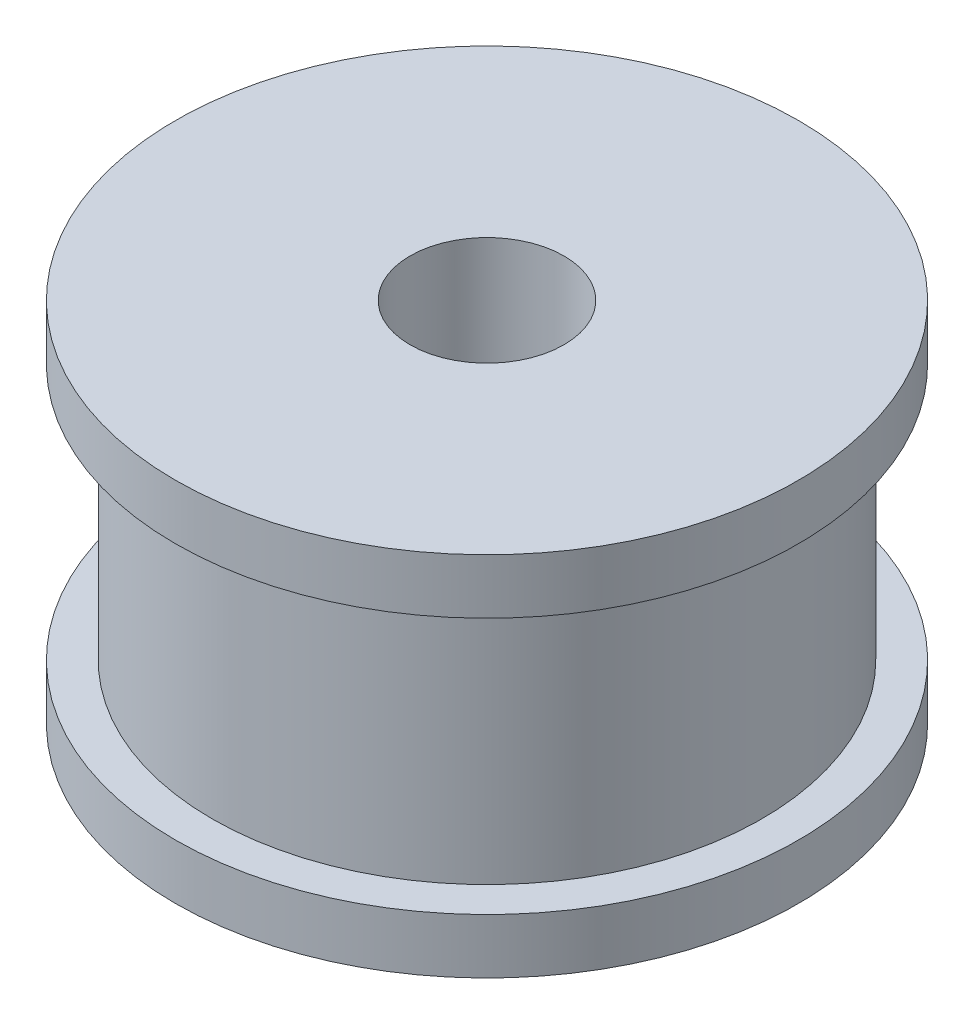
from build123d import *

# Parameters (mm, degrees)
SKETCH_1_R      = 7.5
SKETCH_1_R_2    = 2.1
EXTRUDE_1_DEPTH = 7
SKETCH_2_R      = 8.5
SKETCH_2_R_2    = 2.1
EXTRUDE_2_DEPTH = 1.5
EXTRUDE_START   = 1.5
SKETCH_3_R      = 8.5
SKETCH_3_R_2    = 2.1
EXTRUDE_3_DEPTH = 1.5


with BuildPart() as part:
    # 草图1 → 凸台-拉伸1 (new body)
    with BuildSketch(Plane(origin=(0, 0, 0), x_dir=(1, 0, 0), z_dir=(0, 1, 0))):
        with Locations(Location((0, 0, 0), (0, 0, 270))):
            Circle(SKETCH_1_R)
        with Locations(Location((0, 0, 0), (0, 0, 270))):
            Circle(SKETCH_1_R_2, mode=Mode.SUBTRACT)
    extrude(amount=EXTRUDE_1_DEPTH)

    # 草图2 → 凸台-拉伸2 (add)
    with BuildSketch(Plane(origin=(0, 7, 0), x_dir=(1, 0, 0), z_dir=(0, 1, 0))):
        with Locations(Location((0, 0, 0), (0, 0, 270))):
            Circle(SKETCH_2_R)
        with Locations(Location((0, 0, 0), (0, 0, 270))):
            Circle(SKETCH_2_R_2, mode=Mode.SUBTRACT)
    extrude(amount=EXTRUDE_2_DEPTH)

    # 草图3 → 凸台-拉伸3 (add)
    with BuildSketch(Plane.XZ.offset(EXTRUDE_START)):
        with Locations(Location((0, 0, 0), (0, 0, 90))):
            Circle(SKETCH_3_R)
        with Locations(Location((0, 0, 0), (0, 0, 270))):
            Circle(SKETCH_3_R_2, mode=Mode.SUBTRACT)
    extrude(amount=-EXTRUDE_3_DEPTH)


solid = part.part
